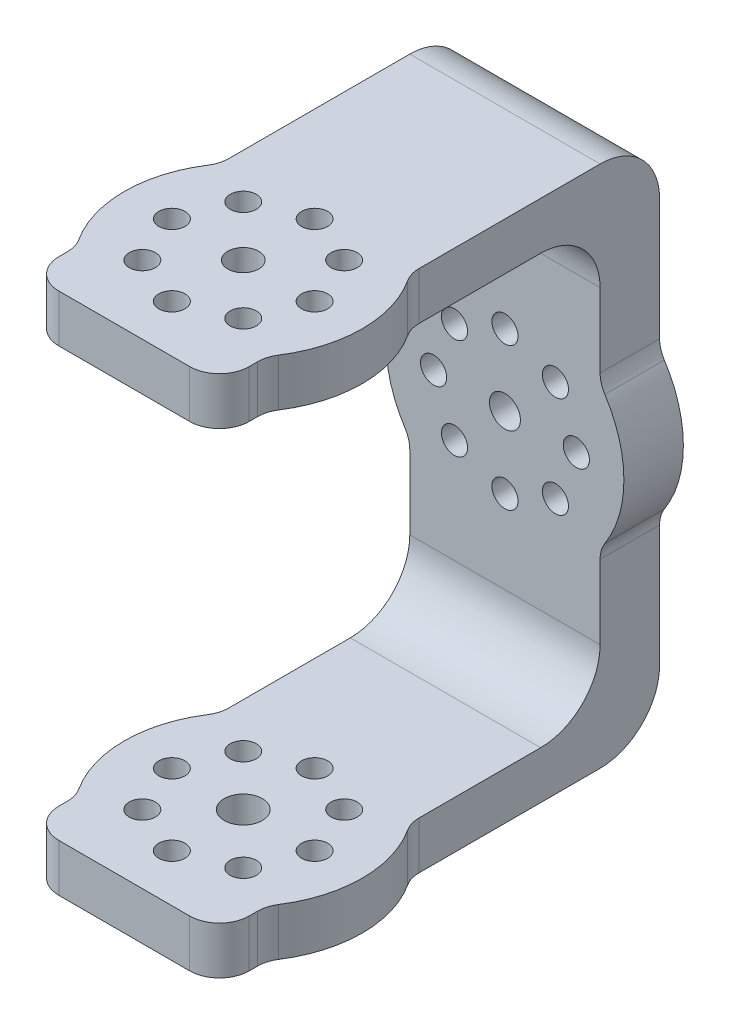
from build123d import *

# Parameters (mm, degrees)
SKETCH_1_R      = 1.3
SKETCH_1_R_2    = 1.1
EXTRUDE_1_DEPTH = 5
SKETCH_2_R      = 1.6
SKETCH_2_R_2    = 1.1
EXTRUDE_2_DEPTH = 4
EXTRUDE_START   = 4
SKETCH_3_R      = 1.1
SKETCH_3_R_2    = 1.3
EXTRUDE_3_DEPTH = 4
FILLET_1_R      = 5
FILLET_2_R      = 2.5


with BuildPart() as part:
    # ｽｹｯﾁ1 → ﾎﾞｽ - 押し出し1 (new body)
    with BuildSketch(Plane.XY):
        with BuildLine():
            Line((-8, 0), (8, 0))
            Line((8, 0), (8, 12))
            ThreePointArc((8, 12), (10, 18), (8, 24))
            Line((8, 24), (8, 36))
            Line((8, 36), (-8, 36))
            Line((-8, 36), (-8, 24))
            ThreePointArc((-8, 24), (-10, 18), (-8, 12))
            Line((-8, 12), (-8, 0))
        make_face()
        with Locations((0, 18)):
            Circle(SKETCH_1_R, mode=Mode.SUBTRACT)
        with Locations((0, 24)):
            Circle(SKETCH_1_R_2, mode=Mode.SUBTRACT)
        with Locations((4.242640687, 22.242640687)):
            Circle(SKETCH_1_R_2, mode=Mode.SUBTRACT)
        with Locations((6, 18)):
            Circle(SKETCH_1_R_2, mode=Mode.SUBTRACT)
        with Locations((4.242640687, 13.757359313)):
            Circle(SKETCH_1_R_2, mode=Mode.SUBTRACT)
        with Locations((0, 12)):
            Circle(SKETCH_1_R_2, mode=Mode.SUBTRACT)
        with Locations((-4.242640687, 13.757359313)):
            Circle(SKETCH_1_R_2, mode=Mode.SUBTRACT)
        with Locations((-6, 18)):
            Circle(SKETCH_1_R_2, mode=Mode.SUBTRACT)
        with Locations((-4.242640687, 22.242640687)):
            Circle(SKETCH_1_R_2, mode=Mode.SUBTRACT)
    extrude(amount=EXTRUDE_1_DEPTH)

    # ｽｹｯﾁ2 → ﾎﾞｽ - 押し出し2 (add)
    with BuildSketch(Plane.XZ):
        with BuildLine():
            Line((-8, 0), (8, 0))
            Line((8, 0), (8, 21))
            ThreePointArc((8, 21), (10, 27), (8, 33))
            Line((8, 33), (8, 37))
            Line((8, 37), (-8, 37))
            Line((-8, 37), (-8, 33))
            ThreePointArc((-8, 33), (-10, 27), (-8, 21))
            Line((-8, 21), (-8, 0))
        make_face()
        with Locations(Location((0, 27, 0), (0, 0, 270))):
            Circle(SKETCH_2_R, mode=Mode.SUBTRACT)
        with Locations(Location((6, 27, 0), (0, 0, 270))):
            Circle(SKETCH_2_R_2, mode=Mode.SUBTRACT)
        with Locations(Location((4.242640687, 22.757359313, 0), (0, 0, 270))):
            Circle(SKETCH_2_R_2, mode=Mode.SUBTRACT)
        with Locations(Location((0, 21, 0), (0, 0, 270))):
            Circle(SKETCH_2_R_2, mode=Mode.SUBTRACT)
        with Locations(Location((-4.242640687, 22.757359313, 0), (0, 0, 270))):
            Circle(SKETCH_2_R_2, mode=Mode.SUBTRACT)
        with Locations(Location((-6, 27, 0), (0, 0, 270))):
            Circle(SKETCH_2_R_2, mode=Mode.SUBTRACT)
        with Locations(Location((-4.242640687, 31.242640687, 0), (0, 0, 270))):
            Circle(SKETCH_2_R_2, mode=Mode.SUBTRACT)
        with Locations(Location((0, 33, 0), (0, 0, 270))):
            Circle(SKETCH_2_R_2, mode=Mode.SUBTRACT)
        with Locations(Location((4.242640687, 31.242640687, 0), (0, 0, 270))):
            Circle(SKETCH_2_R_2, mode=Mode.SUBTRACT)
    extrude(amount=EXTRUDE_2_DEPTH)

    # ｽｹｯﾁ3 → ﾎﾞｽ - 押し出し3 (add)
    with BuildSketch(Plane(origin=(0, 36, 0), x_dir=(1, 0, 0), z_dir=(0, 1, 0)).offset(EXTRUDE_START)):
        with BuildLine():
            Line((8, -5), (8, 0))
            Line((8, 0), (-8, 0))
            Line((-8, 0), (-8, -5))
            Line((-8, -5), (-8, -21))
            ThreePointArc((-8, -21), (-10, -27), (-8, -33))
            Line((-8, -33), (-8, -37))
            Line((-8, -37), (8, -37))
            Line((8, -37), (8, -33))
            ThreePointArc((8, -33), (10, -27), (8, -21))
            Line((8, -21), (8, -5))
        make_face()
        with Locations(Location((4.242640687, -22.757359313, 0), (0, 0, 90))):
            Circle(SKETCH_3_R, mode=Mode.SUBTRACT)
        with Locations(Location((0, -21, 0), (0, 0, 90))):
            Circle(SKETCH_3_R, mode=Mode.SUBTRACT)
        with Locations(Location((-4.242640687, -22.757359313, 0), (0, 0, 90))):
            Circle(SKETCH_3_R, mode=Mode.SUBTRACT)
        with Locations(Location((-6, -27, 0), (0, 0, 90))):
            Circle(SKETCH_3_R, mode=Mode.SUBTRACT)
        with Locations(Location((-4.242640687, -31.242640687, 0), (0, 0, 90))):
            Circle(SKETCH_3_R, mode=Mode.SUBTRACT)
        with Locations(Location((0, -33, 0), (0, 0, 90))):
            Circle(SKETCH_3_R, mode=Mode.SUBTRACT)
        with Locations(Location((4.242640687, -31.242640687, 0), (0, 0, 90))):
            Circle(SKETCH_3_R, mode=Mode.SUBTRACT)
        with Locations(Location((6, -27, 0), (0, 0, 90))):
            Circle(SKETCH_3_R, mode=Mode.SUBTRACT)
        with Locations(Location((0, -27, 0), (0, 0, 270))):
            Circle(SKETCH_3_R_2, mode=Mode.SUBTRACT)
    extrude(amount=-EXTRUDE_3_DEPTH)

    # ﾌｨﾚｯﾄ1
    fillet_1_edges = [part.edges().sort_by_distance(p)[0] for p in [
        (0, 36, 5),
        (0, -4, 0),
        (0, 0, 5),
        (0, 40, 0),
    ]]
    fillet(fillet_1_edges, radius=FILLET_1_R)

    # ﾌｨﾚｯﾄ2
    fillet_2_edges = [part.edges().sort_by_distance(p)[0] for p in [
        (8, 38, 21),
        (-8, 38, 21),
        (-8, 38, 33),
        (-8, 38, 37),
        (8, 38, 37),
        (8, 38, 33),
        (-8, 12, 2.5),
        (-8, 24, 2.5),
        (8, 24, 2.5),
        (8, 12, 2.5),
        (-8, -2, 21),
        (8, -2, 21),
        (8, -2, 33),
        (8, -2, 37),
        (-8, -2, 37),
        (-8, -2, 33),
    ]]
    fillet(fillet_2_edges, radius=FILLET_2_R)


solid = part.part
